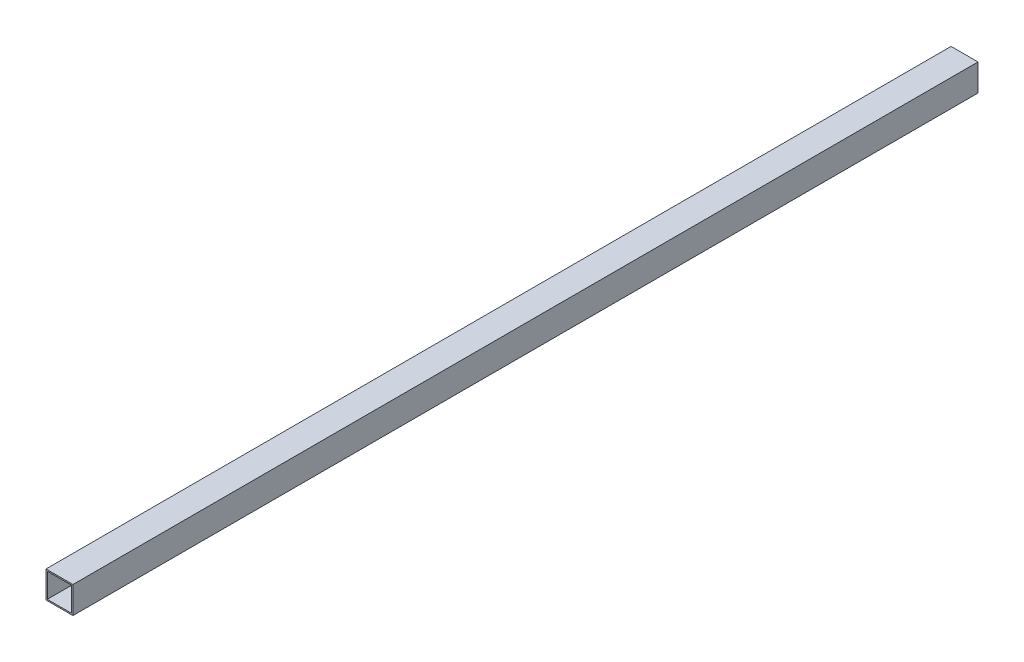
from build123d import *

# Parameters (mm, degrees)
SKETCH1_W           = 25
SKETCH1_H           = 25
SKETCH1_W_2         = 22.6
SKETCH1_H_2         = 22.6
BOSS_EXTRUDE1_DEPTH = 840


with BuildPart() as part:
    # Sketch1 → Boss-Extrude1 (new body)
    with BuildSketch(Plane.XY):
        Rectangle(SKETCH1_W, SKETCH1_H)
        Rectangle(SKETCH1_W_2, SKETCH1_H_2, mode=Mode.SUBTRACT)
    extrude(amount=BOSS_EXTRUDE1_DEPTH)


solid = part.part
